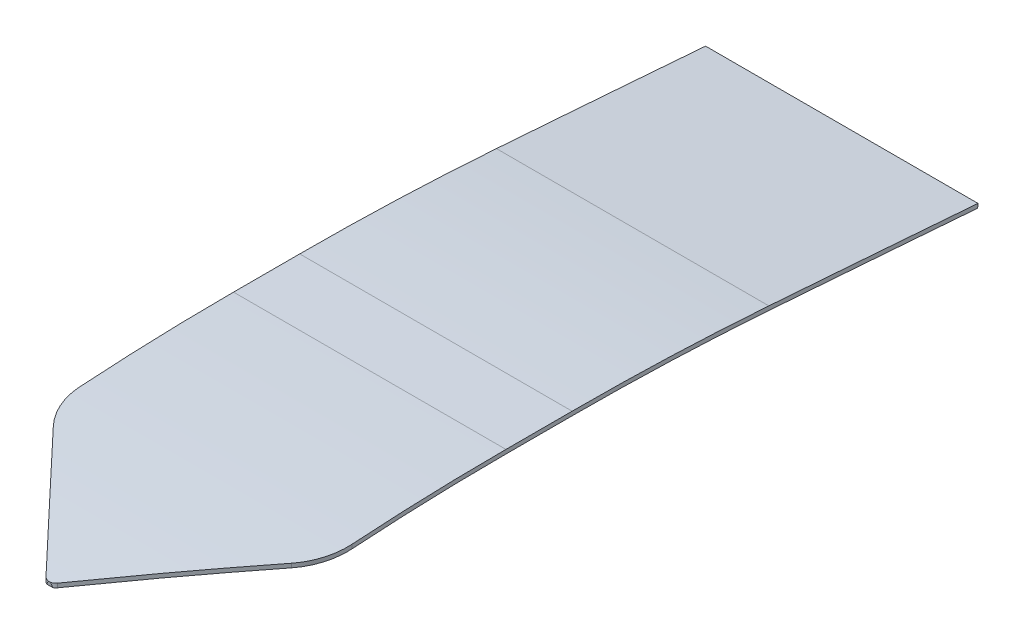
from build123d import *

# Parameters (mm, degrees)
BOSS_EXTRUDE1_DEPTH      = 1562
BOSS_EXTRUDE1_DEPTH_BACK = 176
SKETCH2_W                = 3363.575860712
SKETCH2_H                = 5970.454949978
CUT_EXTRUDE2_DEPTH       = 6472


with BuildPart() as part:
    # Sketch1 → Boss-Extrude1 (new, two sides: drawn at the far end of the back side and taken through both)
    with BuildSketch(Plane(origin=(221.223204368, 2174.889348435, 3089.353639068), x_dir=(0, 0, -1), z_dir=(1, 0, 0)).offset(-BOSS_EXTRUDE1_DEPTH_BACK)):
        with BuildLine():
            Line((418.470256952, 343.848259545), (835.79936838, 343.848259545))
            ThreePointArc((835.79936838, 343.848259545), (1134.545393582, 341.22748792), (1433.199462208, 333.365979742))
            ThreePointArc((1433.199462208, 333.365979742), (1566.571910766, 328.160677129), (1699.899462208, 321.910138249))
            ThreePointArc((1699.899462208, 321.910138249), (1888.304064269, 311.290467655), (2076.579417193, 298.58365992))
            ThreePointArc((2076.579417193, 298.58365992), (2736.086325953, 249.582434707), (3395.470256952, 198.953250272))
            Line((3395.470256952, 198.953250272), (3393.494444982, 173.63021398))
            ThreePointArc((3393.494444982, 173.63021398), (2734.173034363, 224.25459794), (2074.728657642, 273.251177036))
            ThreePointArc((2074.728657642, 273.251177036), (1886.73413806, 285.939031173), (1698.61056213, 296.542861364))
            ThreePointArc((1698.61056213, 296.542861364), (1565.481883357, 302.784076879), (1432.308374436, 307.981615212))
            ThreePointArc((1432.308374436, 307.981615212), (1134.099781114, 315.831397088), (835.79936838, 318.448259545))
            Line((835.79936838, 318.448259545), (418.470256952, 318.448259545))
            ThreePointArc((418.470256952, 318.448259545), (-592.723275589, 283.160995459), (-1598.997170307, 177.470882066))
            Line((-1598.997170307, 177.470882066), (-1602.529743048, 202.624031567))
            ThreePointArc((-1602.529743048, 202.624031567), (-594.493869087, 308.499207682), (418.470256952, 343.848259545))
        make_face()
    extrude(amount=BOSS_EXTRUDE1_DEPTH + BOSS_EXTRUDE1_DEPTH_BACK)

    # Sketch2 → Cut-Extrude2 (cut)
    with BuildSketch(Plane(origin=(0, 0, 0), x_dir=(1, 0, 0), z_dir=(0, 1, 0))):
        with Locations((788.511086427, -1905.513066648)):
            Rectangle(SKETCH2_W, SKETCH2_H)
        with BuildLine():
            Line((950.670011749, -4676.112466704), (1664.797663416, -3915.71605882))
            ThreePointArc((1664.797663416, -3915.71605882), (1745.130305415, -3789.142025972), (1773.223204368, -3641.883382116))
            Line((1773.223204368, -3641.883382116), (1773.223204368, 306.116617884))
            Line((1773.223204368, 306.116617884), (55.223204368, 306.116617884))
            Line((55.223204368, 306.116617884), (55.223204368, -3641.883382116))
            ThreePointArc((55.223204368, -3641.883382116), (83.31610332, -3789.142025972), (163.648745319, -3915.71605882))
            Line((163.648745319, -3915.71605882), (877.776396987, -4676.112466704))
            ThreePointArc((877.776396987, -4676.112466704), (914.223204368, -4691.883382116), (950.670011749, -4676.112466704))
        make_face(mode=Mode.SUBTRACT)
    extrude(amount=CUT_EXTRUDE2_DEPTH, mode=Mode.SUBTRACT)


solid = part.part
